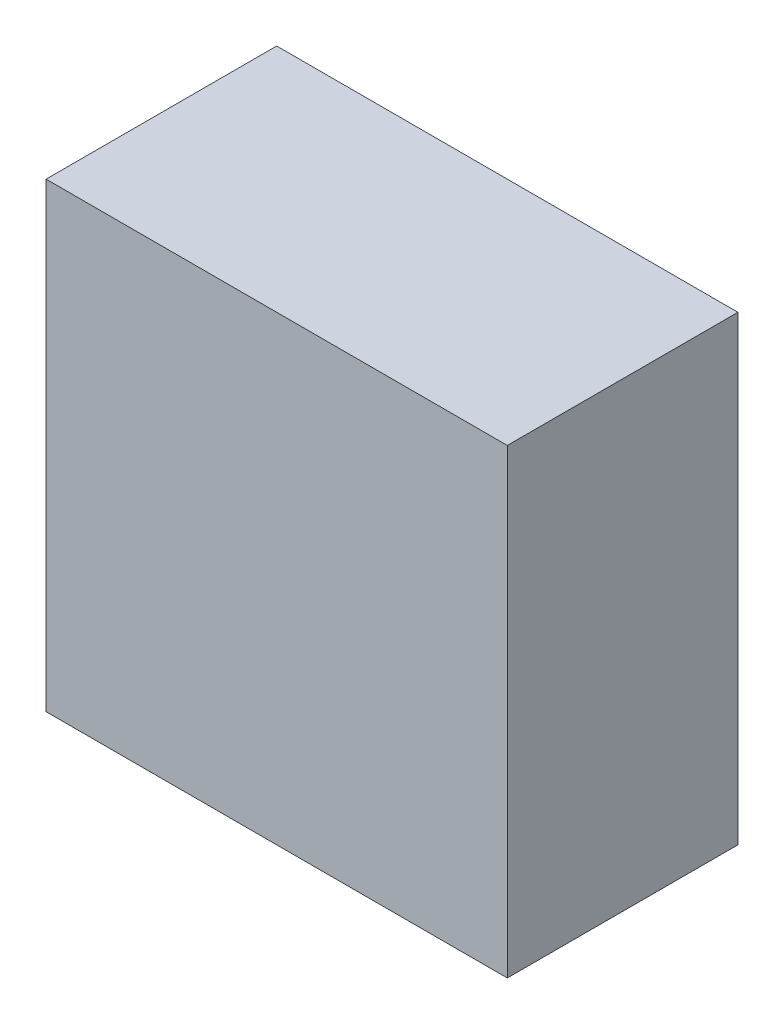
from build123d import *

# Parameters (mm, degrees)
SKICA1_W                 = 20
SKICA1_H                 = 20
P_IDAT_VYSUNUT_M1_DEPTH  = 10
SKICA2_W                 = 17
SKICA2_H                 = 17
ODEBRAT_VYSUNUT_M1_DEPTH = 7.5
SKICA3_R                 = 2.65
P_IDAT_VYSUNUT_M2_DEPTH  = 7.5
ODEBRAT_VYSUNUT_M2_DEPTH = 7.5


with BuildPart() as part:
    # Skica1 → Přidat vysunutím1 (new body)
    with BuildSketch(Plane.XY):
        Rectangle(SKICA1_W, SKICA1_H)
    extrude(amount=P_IDAT_VYSUNUT_M1_DEPTH)

    # Skica2 → Odebrat vysunutím1 (cut)
    with BuildSketch(Plane(origin=(0, 0, 0), x_dir=(-1, 0, 0), z_dir=(0, 0, -1))):
        Rectangle(SKICA2_W, SKICA2_H)
    extrude(amount=-ODEBRAT_VYSUNUT_M1_DEPTH, mode=Mode.SUBTRACT)

    # Skica3 → Přidat vysunutím2 (add)
    with BuildSketch(Plane(origin=(0, 0, 7.5), x_dir=(-1, 0, 0), z_dir=(0, 0, -1))):
        with Locations(Location((0, 0, 0), (0, 0, 180))):
            Circle(SKICA3_R)
    extrude(amount=P_IDAT_VYSUNUT_M2_DEPTH)

    # Skica4 → Odebrat vysunutím2 (cut)
    with BuildSketch(Plane(origin=(0, 0, 0), x_dir=(-1, 0, 0), z_dir=(0, 0, -1))):
        Polygon((-0.7, 2.15), (0.7, 2.15), (0.7, 0.7), (2.15, 0.7), (2.15, -0.7), (0.7, -0.7), (0.7, -2.15), (-0.7, -2.15), (-0.7, -0.7), (-2.15, -0.7), (-2.15, 0.7), (-0.7, 0.7), align=None)
    extrude(amount=-ODEBRAT_VYSUNUT_M2_DEPTH, mode=Mode.SUBTRACT)


solid = part.part
